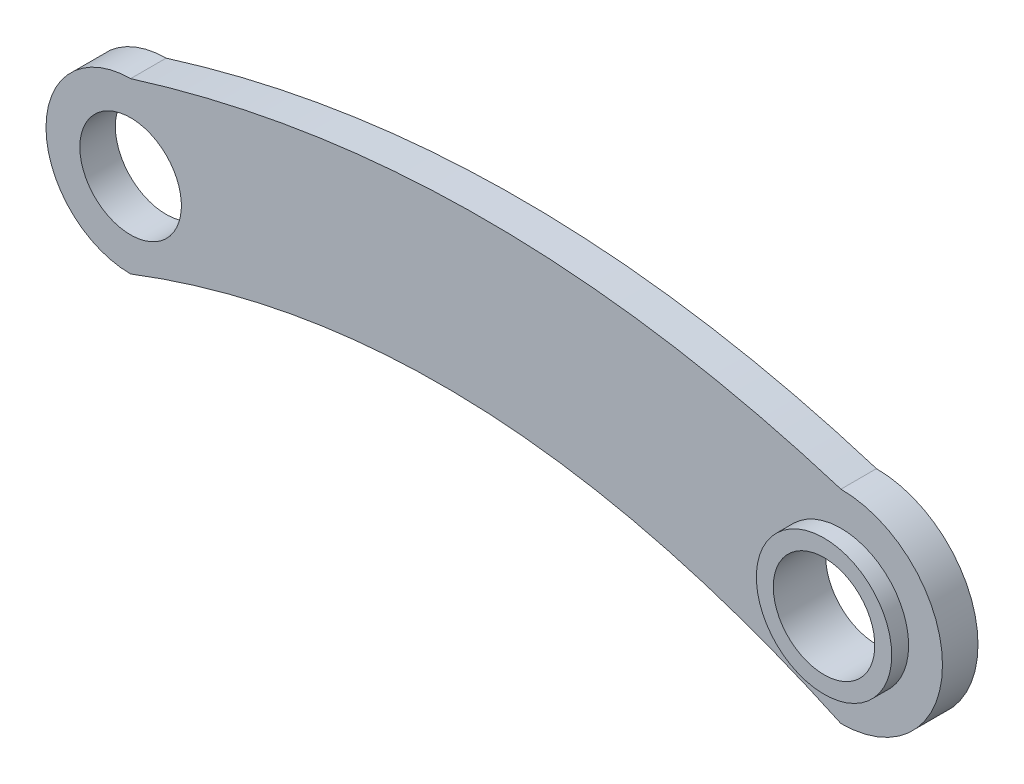
from build123d import *

# Parameters (mm, degrees)
BOSS_EXTRUDE1_DEPTH = 21
SKETCH2_R           = 30
CUT_EXTRUDE1_DEPTH  = 527.362693656
SKETCH4_R           = 40
SKETCH4_R_2         = 30
BOSS_EXTRUDE3_DEPTH = 10


with BuildPart() as part:
    # Sketch1 → Boss-Extrude1 (new body)
    with BuildSketch(Plane.XY):
        with BuildLine():
            add(Edge.make_bspline(
                [(-267.733324074, 386.480114093), (-58.376892778, 451.86591416), (152.142574227, 386.270803333)],
                knots=[0, 0, 0, 1, 1, 1], degree=2))
            ThreePointArc((-267.733324074, 386.480114093), (-317.733324074, 336.480114093), (-267.733324074, 286.480114093))
            add(Edge.make_bspline(
                [(-267.733324074, 286.480114093), (-61.536299878, 365.758634067), (152.142574227, 266.270803333)],
                knots=[0, 0, 0, 1, 1, 1], degree=2))
            ThreePointArc((152.142574227, 266.270803333), (212.142574227, 326.270803333), (152.142574227, 386.270803333))
        make_face()
    extrude(amount=BOSS_EXTRUDE1_DEPTH)

    # Sketch2 → Cut-Extrude1 (cut, through all)
    with BuildSketch(Plane.XY):
        with Locations((-267.733324074, 336.480114093)):
            Circle(SKETCH2_R)
        with Locations((152.142574227, 326.270803333)):
            Circle(SKETCH2_R)
    extrude(amount=CUT_EXTRUDE1_DEPTH, mode=Mode.SUBTRACT)

    # Sketch4 → Boss-Extrude3 (add)
    with BuildSketch(Plane.XY.offset(21)):
        with Locations((152.142574227, 326.270803333)):
            Circle(SKETCH4_R)
        with Locations((152.142574227, 326.270803333)):
            Circle(SKETCH4_R_2, mode=Mode.SUBTRACT)
    extrude(amount=BOSS_EXTRUDE3_DEPTH)


solid = part.part
